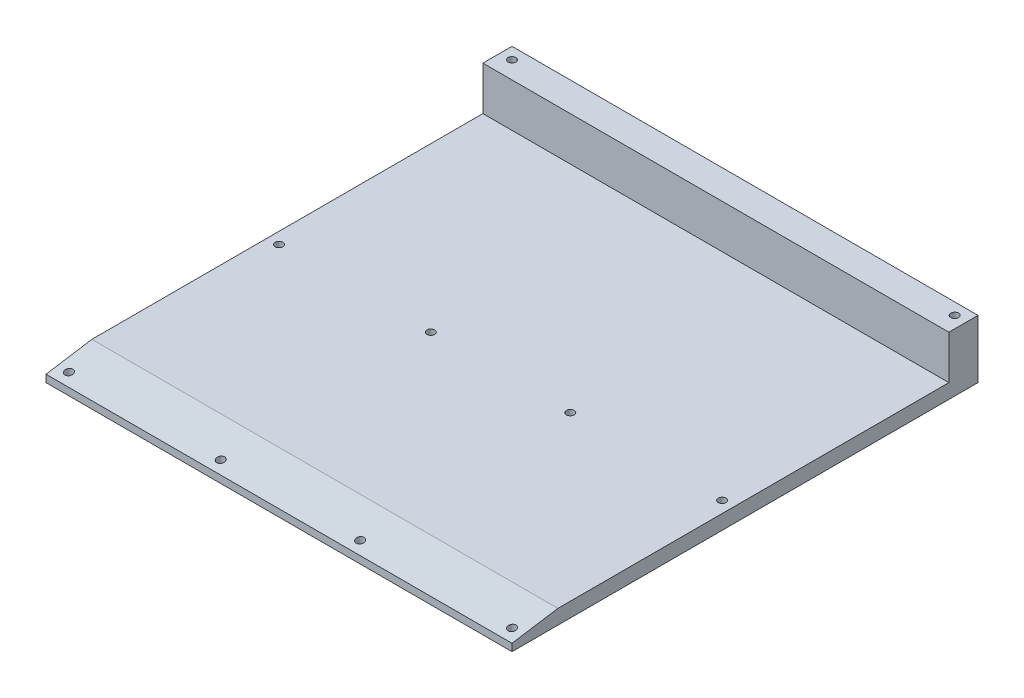
from build123d import *

# Parameters (mm, degrees)
SKETCH1_W           = 76.2
SKETCH1_H           = 101.6
BOSS_EXTRUDE1_DEPTH = 6.35
SKETCH2_R           = 1.7
CUT_EXTRUDE1_DEPTH  = 218.110576665
CUT_EXTRUDE2_DEPTH  = 218.110576665
BOSS_EXTRUDE2_DEPTH = 50.8
BOSS_EXTRUDE5_START = 19.05
SKETCH8_W           = 203.2
SKETCH8_H           = 12.7
SKETCH8_R           = 1.7
BOSS_EXTRUDE5_DEPTH = 19.05


with BuildPart() as part:
    # Sketch1 → Boss-Extrude1 (new body)
    with BuildSketch(Plane(origin=(0, 0, 0), x_dir=(1, 0, 0), z_dir=(0, 1, 0))):
        with Locations((38.1, 50.8)):
            Rectangle(SKETCH1_W, SKETCH1_H)
        with Locations((38.1, 152.4)):
            Rectangle(SKETCH1_W, SKETCH1_H)
    extrude(amount=BOSS_EXTRUDE1_DEPTH)

    # Sketch2 → Cut-Extrude1 (cut, through all)
    with BuildSketch(Plane(origin=(0, 6.35, 0), x_dir=(1, 0, 0), z_dir=(0, 1, 0))):
        with Locations(Location((5, 96.6, 0), (0, 0, 270))):
            Circle(SKETCH2_R)
        with Locations(Location((71.2, 96.6, 0), (0, 0, 270))):
            Circle(SKETCH2_R)
        with Locations(Location((5, 5, 0), (0, 0, 270))):
            Circle(SKETCH2_R)
        with Locations(Location((71.2, 5, 0), (0, 0, 270))):
            Circle(SKETCH2_R)
        with Locations(Location((71.12, 198.12, 0), (0, 0, 270))):
            Circle(SKETCH2_R)
    extrude(amount=-CUT_EXTRUDE1_DEPTH, mode=Mode.SUBTRACT)

    # Sketch3 → Cut-Extrude2 (cut, through all)
    with BuildSketch(Plane.ZY):
        Polygon((-20, 6.35), (0, 3.175), (0, 6.35), align=None)
    extrude(amount=-CUT_EXTRUDE2_DEPTH, mode=Mode.SUBTRACT)


with BuildPart() as body_2:
    # Mirror3: mirrored copy
    add(part.part.mirror(Plane.ZY.offset(25.4)))


with BuildPart() as part_1:
    add(part.part)

    add(body_2.part)  # Boss-Extrude2 merges body 2
    # Sketch5 → Boss-Extrude2 (add)
    with BuildSketch(Plane(origin=(-50.8, 0, 0), x_dir=(0, 0, -1), z_dir=(1, 0, 0))):
        Polygon((20, 6.35), (203.2, 6.35), (203.2, 0), (0, 0), (0, 3.175), align=None)
    extrude(amount=BOSS_EXTRUDE2_DEPTH)

    # Sketch8 → Boss-Extrude5 (add)
    with BuildSketch(Plane(origin=(0, 6.35, 0), x_dir=(1, 0, 0), z_dir=(0, 1, 0)).offset(BOSS_EXTRUDE5_START)):
        with Locations((-25.4, 196.85)):
            Rectangle(SKETCH8_W, SKETCH8_H)
        with Locations(Location((-121.92, 198.12, 0), (0, 0, 270))):
            Circle(SKETCH8_R, mode=Mode.SUBTRACT)
        with Locations(Location((71.12, 198.12, 0), (0, 0, 270))):
            Circle(SKETCH8_R, mode=Mode.SUBTRACT)
    extrude(amount=-BOSS_EXTRUDE5_DEPTH)


solid = part_1.part
